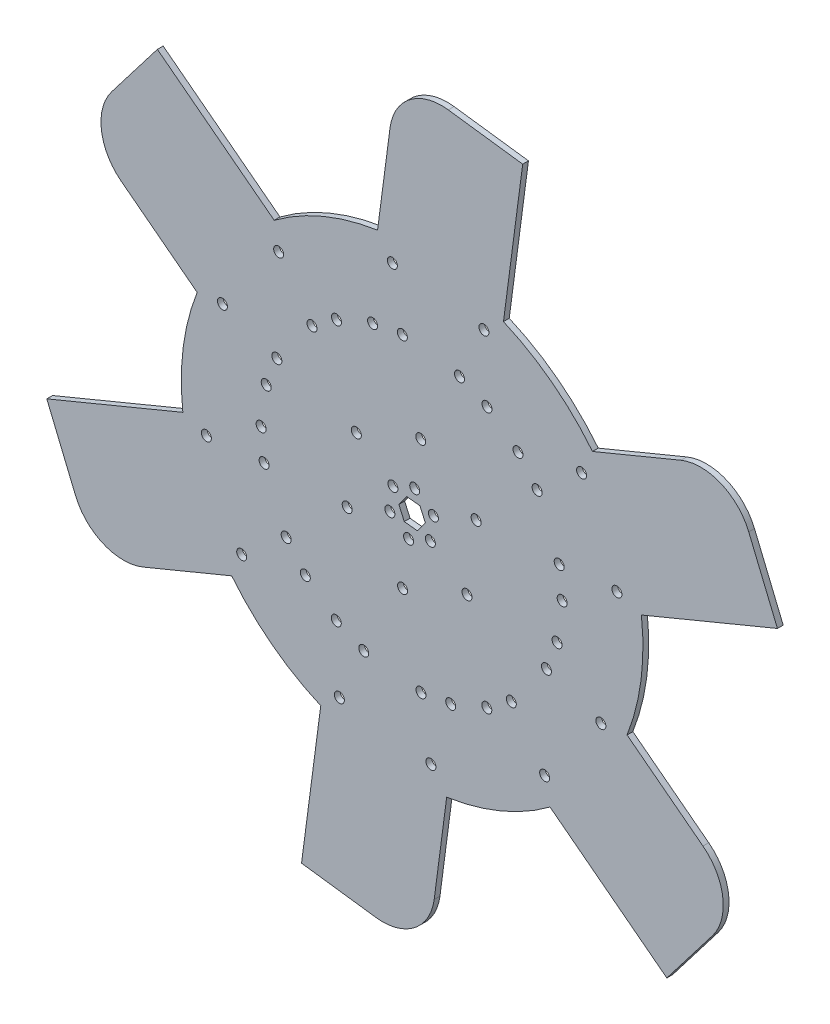
from build123d import *

# Parameters (mm, degrees)
SKETCH1_R            = 127
BOSS_EXTRUDE1_DEPTH  = 3.175
M5_CLEARANCE_HOLE1_D = 5.5
CIRPATTERN1_COUNT    = 6
BOSS_EXTRUDE2_DEPTH  = 3.175
CIRPATTERN2_COUNT    = 6
CUT_EXTRUDE1_DEPTH   = 286.374530912


with BuildPart() as part:
    # Sketch1 → Boss-Extrude1 (new body)
    with BuildSketch(Plane.XY):
        Circle(SKETCH1_R)
    extrude(amount=BOSS_EXTRUDE1_DEPTH)

    # M5 Clearance Hole1 (through all)
    with Locations(Plane(origin=(0, 0, 0), x_dir=(-1, 0, 0), z_dir=(0, 0, -1))):
        with Locations((-58.2494214, 58.493652703), (-82.549819355, -0.172697611), (-93.238867767, 66.113565457), (-112.679186132, 19.180485205), (-11.733270063, 4.860079591), (-68.767621753, 45.667457762), (-80.917820731, 16.334282605), (-35.199810189, 14.580238773)):
            m5_clearance_hole1 = Hole(M5_CLEARANCE_HOLE1_D / 2)

    # CirPattern1: M5 Clearance Hole1 ×6 about axis
    cirpattern1_axis = Axis((-0.255716285, -0.105921153, 0), (0, 0, 1))
    for i in range(1, CIRPATTERN1_COUNT):
        add(m5_clearance_hole1.rotate(cirpattern1_axis, i * 360 / CIRPATTERN1_COUNT), mode=Mode.SUBTRACT)

    # Sketch6 → Boss-Extrude2 (add)
    with BuildSketch(Plane(origin=(0, 0, 0), x_dir=(-1, 0, 0), z_dir=(0, 0, -1))):
        with BuildLine():
            Line((-97.979344732, 78.730580539), (-147.8457425, 99.385918801))
            ThreePointArc((-147.8457425, 99.385918801), (-169.716100659, 99.385918801), (-185.180779221, 83.92124024))
            Line((-185.180779221, 83.92124024), (-200.976037892, 45.788112535))
            Line((-200.976037892, 45.788112535), (-124.709782483, 14.197595193))
            Line((-124.709782483, 14.197595193), (-97.979344732, 78.730580539))
        make_face()
    boss_extrude2 = extrude(amount=-BOSS_EXTRUDE2_DEPTH)

    # CirPattern2: Boss-Extrude2 ×6 about axis
    cirpattern2_axis = Axis((0, 0, 0), (0, 0, 1))
    for i in range(1, CIRPATTERN2_COUNT):
        add(boss_extrude2.rotate(cirpattern2_axis, i * 360 / CIRPATTERN2_COUNT))

    # Sketch7 → Cut-Extrude1 (cut, through all)
    with BuildSketch(Plane.XY.offset(3.175)):
        Polygon((7.292181047, -0.766439112), (4.309846265, 5.931994479), (-2.982334782, 6.698433592), (-7.292181047, 0.766439112), (-4.309846265, -5.931994479), (2.982334782, -6.698433592), align=None)
    extrude(amount=-CUT_EXTRUDE1_DEPTH, mode=Mode.SUBTRACT)


solid = part.part
